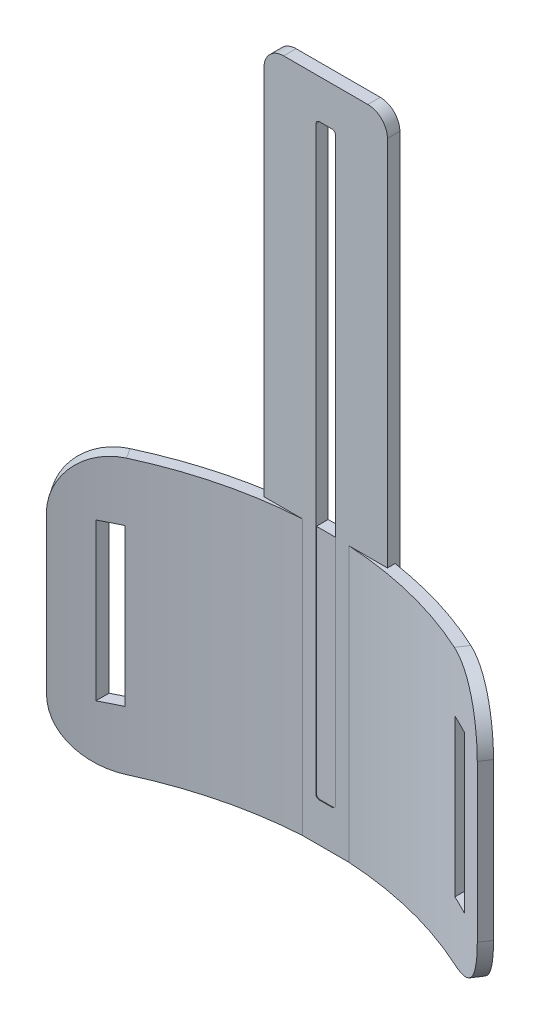
from build123d import *

# Parameters (mm, degrees)
SKETCH1_W           = 31.5
SKETCH1_H           = 170
SKETCH1_W_2         = 5.08
SKETCH1_H_2         = 150
BOSS_EXTRUDE1_DEPTH = 3.175
FILLET1_R           = 1
FILLET2_R           = 5
BOSS_EXTRUDE2_DEPTH = 70
FILLET3_R           = 15
SKETCH4_W           = 5
SKETCH4_H           = 40
CUT_EXTRUDE5_DEPTH  = 104.989569915


with BuildPart() as part:
    # Sketch1 → Boss-Extrude1 (new body)
    with BuildSketch(Plane.XY):
        Rectangle(SKETCH1_W, SKETCH1_H)
        Rectangle(SKETCH1_W_2, SKETCH1_H_2, mode=Mode.SUBTRACT)
    extrude(amount=BOSS_EXTRUDE1_DEPTH)

    # Fillet1
    fillet1_edges = [part.edges().sort_by_distance(p)[0] for p in [
        (2.54, 75, 1.5875),
        (-2.54, 75, 1.5875),
        (-2.54, -75, 1.5875),
        (2.54, -75, 1.5875),
    ]]
    fillet(fillet1_edges, radius=FILLET1_R)

    # Fillet2
    fillet2_edges = [part.edges().sort_by_distance(p)[0] for p in [
        (15.75, 85, 1.5875),
        (15.75, -85, 1.5875),
        (-15.75, -85, 1.5875),
        (-15.75, 85, 1.5875),
    ]]
    fillet(fillet2_edges, radius=FILLET2_R)

    # Sketch3 → Boss-Extrude2 (add)
    with BuildSketch(Plane(origin=(0, -85, 0), x_dir=(1, 0, 0), z_dir=(0, 1, 0))):
        with BuildLine():
            Line((-56.65, -16.978040594), (-55, -19.483534558))
            ThreePointArc((-55, -19.483534558), (0, -3), (55, -19.483534558))
            Line((55, -19.483534558), (56.65, -16.978040594))
            ThreePointArc((56.65, -16.978040594), (0, 0), (-56.65, -16.978040594))
        make_face()
    extrude(amount=BOSS_EXTRUDE2_DEPTH)

    # Fillet3
    fillet3_edges = [part.edges().sort_by_distance(p)[0] for p in [
        (55.825, -85, 18.230787576),
        (-55.825, -85, 18.230787576),
        (-55.825, -15, 18.230787576),
        (55.825, -15, 18.230787576),
    ]]
    fillet(fillet3_edges, radius=FILLET3_R)

    # Sketch4 → Cut-Extrude5 (cut, symmetric)
    with BuildSketch(Plane.XY):
        with Locations((-44.5945609, -50)):
            Rectangle(SKETCH4_W, SKETCH4_H)
    cut_extrude5 = extrude(amount=CUT_EXTRUDE5_DEPTH, both=True, mode=Mode.SUBTRACT)

    # Mirror1: Cut-Extrude5 across plane
    add(cut_extrude5.mirror(Plane(origin=(0, 0, 0), x_dir=(0, 0, 1), z_dir=(1, 0, 0))), mode=Mode.SUBTRACT)


solid = part.part
